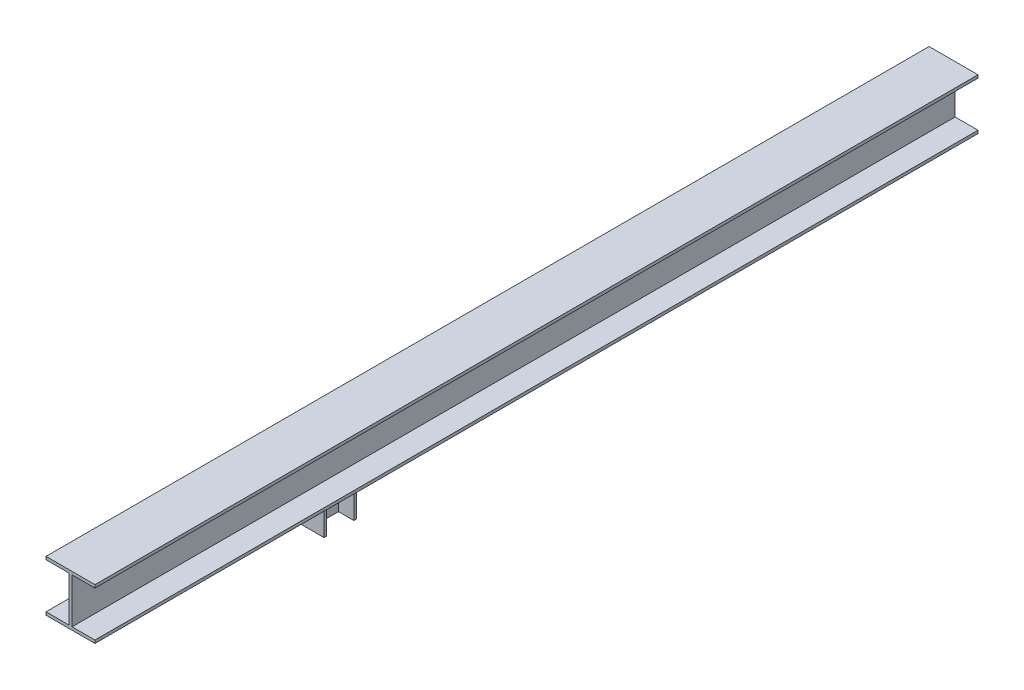
from build123d import *

# Parameters (mm, degrees)
BOSS_EXTRUDE7_DEPTH = 5500
BOSS_EXTRUDE8_DEPTH = 195.5


with BuildPart() as part:
    # Sketch7 → Boss-Extrude7 (new body)
    with BuildSketch(Plane.XY):
        Polygon((100.25706083, 502.42188857), (242.907060835, 502.42188857), (242.907060835, 520.92188857), (-61.8929392, 520.92188857), (-61.8929392, 502.42188857), (80.7570608, 502.42188857), (80.7570608, 221.9218886), (-61.8929392, 221.9218886), (-61.8929392, 203.4218886), (242.9070608, 203.4218886), (242.9070608, 221.9218886), (100.25706083, 221.9218886), align=None)
    extrude(amount=BOSS_EXTRUDE7_DEPTH)


with BuildPart() as body_2:
    # Sketch8 → Boss-Extrude8 (new body)
    with BuildSketch(Plane.XZ.offset(-203.4218886)):
        Polygon((-9.4929392, 4020), (190.5070608, 4020), (190.5070608, 4005), (95.0070608, 4005), (95.0070608, 3835), (190.5070608, 3835), (190.5070608, 3820), (-9.4929392, 3820), (-9.4929392, 3835), (86.0070608, 3835), (86.0070608, 4005), (-9.4929392, 4005), align=None)
    extrude(amount=BOSS_EXTRUDE8_DEPTH)


solid = Compound([part.part, body_2.part])
